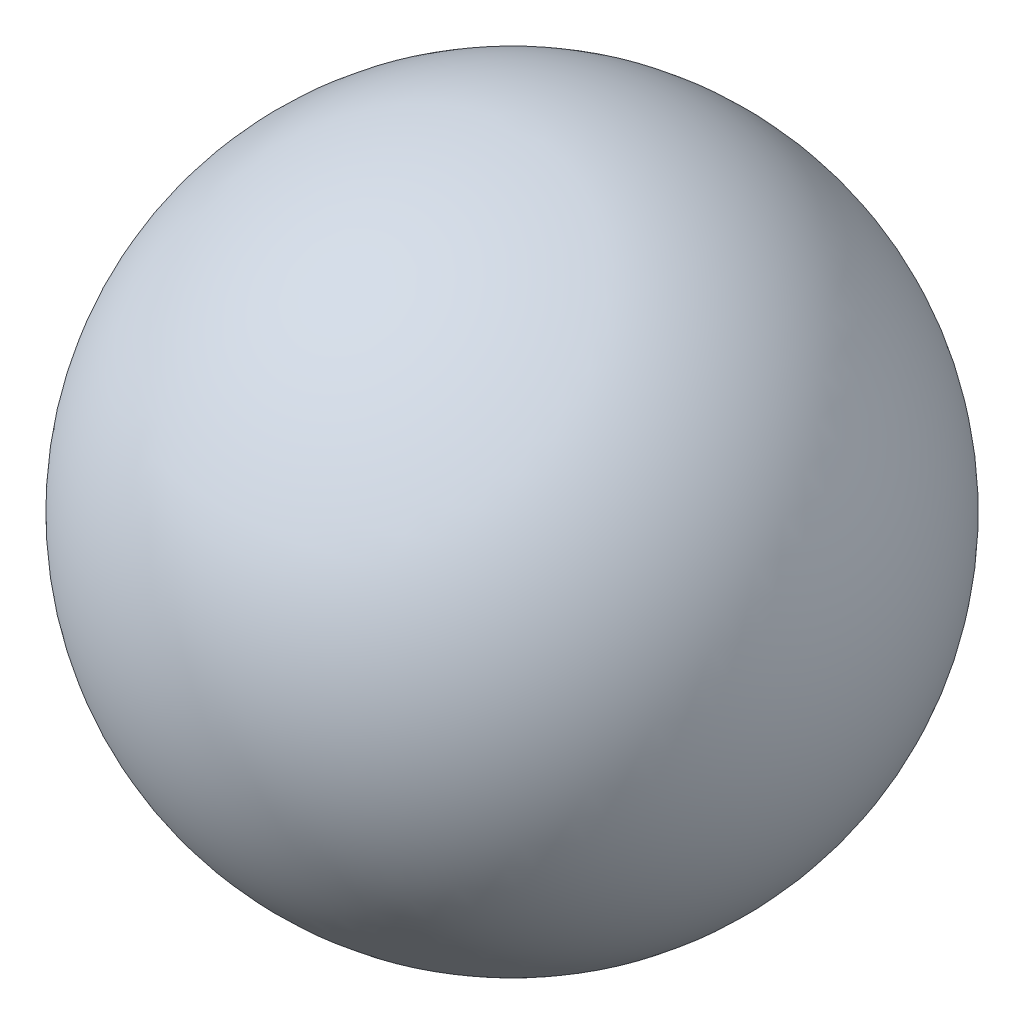
from build123d import *


with BuildPart() as part:
    # Sketch1 → Revolve1 (revolve)
    with BuildSketch(Plane.YZ):
        with BuildLine():
            Line((-30, 0), (30, 0))
            ThreePointArc((30, 0), (0, 30), (-30, 0))
        make_face()
    revolve(axis=Axis((0, -30, 0), (0, 1, 0)))


solid = part.part
